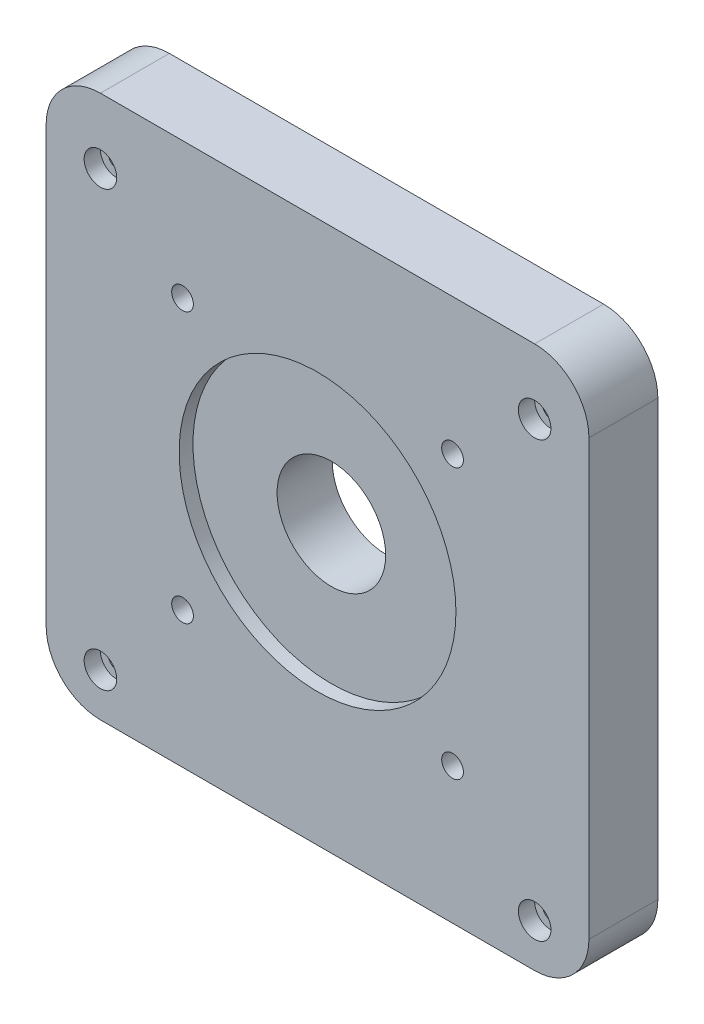
from build123d import *

# Parameters (mm, degrees)
SALIENTE_EXTRUIR1_DEPTH = 12.7
CROQUIS2_R              = 3
CORTAR_EXTRUIR1_DEPTH   = 3
CROQUIS3_R              = 10
CROQUIS3_R_2            = 2
CORTAR_EXTRUIR2_DEPTH   = 31
CROQUIS4_R              = 1.5
CORTAR_EXTRUIR3_DEPTH   = 31
CROQUIS5_R              = 4
CORTAR_EXTRUIR4_DEPTH   = 3
CROQUIS6_R              = 25.5
CORTAR_EXTRUIR5_DEPTH   = 2.55


with BuildPart() as part:
    # Croquis1 → Saliente-Extruir1 (new body)
    with BuildSketch(Plane.XY):
        with BuildLine():
            Line((10, 0), (90, 0))
            ThreePointArc((90, 0), (97.071067812, 2.928932188), (100, 10))
            Line((100, 10), (100, 90))
            ThreePointArc((100, 90), (97.071067812, 97.071067812), (90, 100))
            Line((90, 100), (10, 100))
            ThreePointArc((10, 100), (2.928932188, 97.071067812), (0, 90))
            Line((0, 90), (0, 10))
            ThreePointArc((0, 10), (2.928932188, 2.928932188), (10, 0))
        make_face()
    extrude(amount=SALIENTE_EXTRUIR1_DEPTH)

    # Croquis2 → Cortar-Extruir1 (cut)
    with BuildSketch(Plane.XY.offset(12.7)):
        with Locations((10, 88)):
            Circle(CROQUIS2_R)
        with Locations((10, 8)):
            Circle(CROQUIS2_R)
        with Locations((90, 88)):
            Circle(CROQUIS2_R)
        with Locations((90, 8)):
            Circle(CROQUIS2_R)
    extrude(amount=-CORTAR_EXTRUIR1_DEPTH, mode=Mode.SUBTRACT)

    # Croquis3 → Cortar-Extruir2 (cut)
    with BuildSketch(Plane.XY.offset(12.7)):
        with Locations((50, 50)):
            Circle(CROQUIS3_R)
        with Locations((25.125, 74.875)):
            Circle(CROQUIS3_R_2)
        with Locations((74.875, 74.875)):
            Circle(CROQUIS3_R_2)
        with Locations((25.125, 25.125)):
            Circle(CROQUIS3_R_2)
        with Locations((74.875, 25.125)):
            Circle(CROQUIS3_R_2)
    extrude(amount=-CORTAR_EXTRUIR2_DEPTH, mode=Mode.SUBTRACT)

    # Croquis4 → Cortar-Extruir3 (cut)
    with BuildSketch(Plane.XY.offset(9.7)):
        with Locations((10, 88)):
            Circle(CROQUIS4_R)
        with Locations((90, 88)):
            Circle(CROQUIS4_R)
        with Locations((90, 8)):
            Circle(CROQUIS4_R)
        with Locations((10, 8)):
            Circle(CROQUIS4_R)
    extrude(amount=-CORTAR_EXTRUIR3_DEPTH, mode=Mode.SUBTRACT)

    # Croquis5 → Cortar-Extruir4 (cut)
    with BuildSketch(Plane(origin=(0, 0, 0), x_dir=(-1, 0, 0), z_dir=(0, 0, -1))):
        with Locations((-74.875, 74.875)):
            Circle(CROQUIS5_R)
        with Locations((-25.125, 74.875)):
            Circle(CROQUIS5_R)
        with Locations((-25.125, 25.125)):
            Circle(CROQUIS5_R)
        with Locations((-74.875, 25.125)):
            Circle(CROQUIS5_R)
    extrude(amount=-CORTAR_EXTRUIR4_DEPTH, mode=Mode.SUBTRACT)

    # Croquis6 → Cortar-Extruir5 (cut)
    with BuildSketch(Plane.XY.offset(12.7)):
        with Locations((50, 50)):
            Circle(CROQUIS6_R)
    extrude(amount=-CORTAR_EXTRUIR5_DEPTH, mode=Mode.SUBTRACT)


solid = part.part
